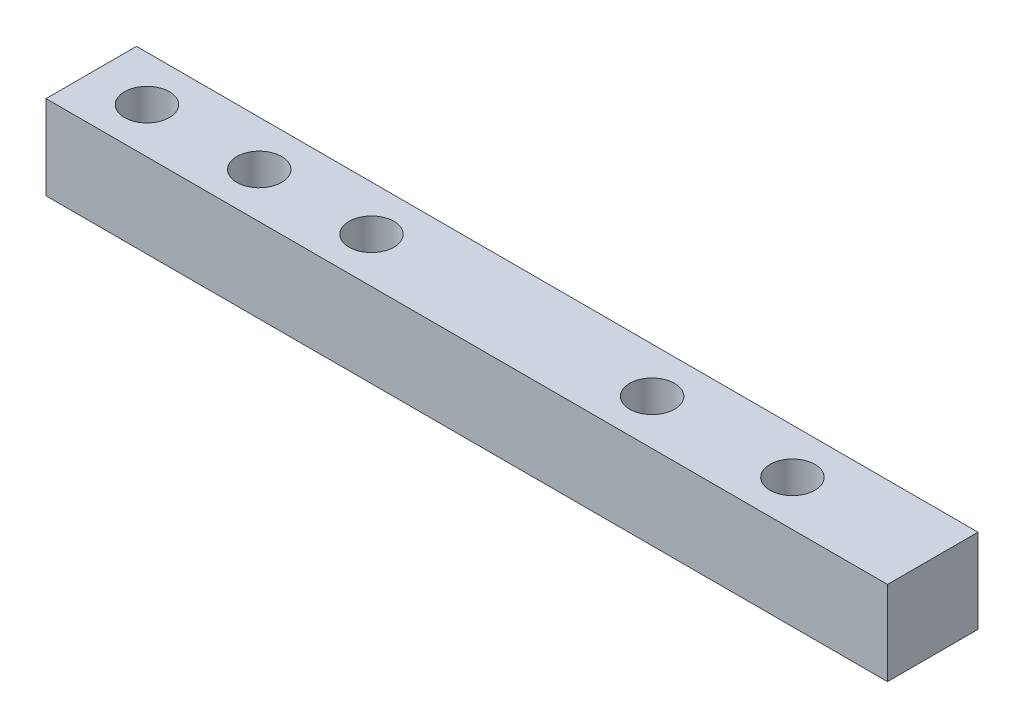
from build123d import *

# Parameters (mm, degrees)
SKETCH1_R           = 0.4
BOSS_EXTRUDE1_DEPTH = 1.5


with BuildPart() as part:
    # Sketch1 → Boss-Extrude1 (new body)
    with BuildSketch(Plane(origin=(0, 0, 0), x_dir=(1, 0, 0), z_dir=(0, 1, 0))):
        Polygon((-55.29426973, 40.850641592), (-55.29426973, 40.044415817), (-55.29426973, 39.238190042), (-40.301565833, 39.238190042), (-40.301565833, 40.850641592), align=None)
        with BuildLine():
            ThreePointArc((-51.901565833, 40.044415817), (-52.301565833, 39.644415817), (-52.701565833, 40.044415817))
            ThreePointArc((-52.701565833, 40.044415817), (-52.301565833, 40.444415817), (-51.901565833, 40.044415817))
        make_face(mode=Mode.SUBTRACT)
        with BuildLine():
            ThreePointArc((-53.901565833, 40.044415817), (-54.301565833, 39.644415817), (-54.701565833, 40.044415817))
            ThreePointArc((-54.701565833, 40.044415817), (-54.301565833, 40.444415817), (-53.901565833, 40.044415817))
        make_face(mode=Mode.SUBTRACT)
        with Locations((-50.301565833, 40.044415817)):
            Circle(SKETCH1_R, mode=Mode.SUBTRACT)
        with Locations((-45.301565833, 40.044415817)):
            Circle(SKETCH1_R, mode=Mode.SUBTRACT)
        with Locations((-42.801565833, 40.044415817)):
            Circle(SKETCH1_R, mode=Mode.SUBTRACT)
    extrude(amount=BOSS_EXTRUDE1_DEPTH)


solid = part.part
